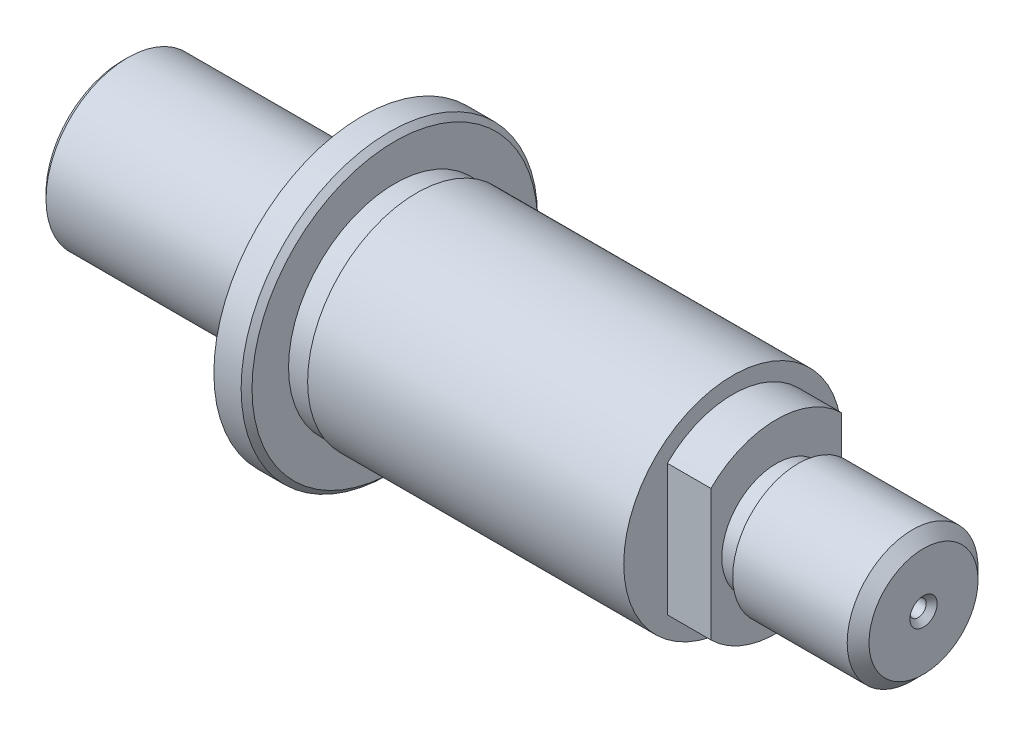
from build123d import *

# Parameters (mm, degrees)
CHANFREIN1_SIZE                     = 0.5
ENL_V_MAT_EXTRU_1_DEPTH             = 4
CHANFREIN2_SIZE                     = 1
DIAM_TRE_DU_PER_AGE_1_5_1_5_1_D     = 1.5
DIAM_TRE_DU_PER_AGE_1_5_1_5_1_DEPTH = 2
DIAM_TRE_DU_PER_AGE_1_5_1_5_1_TIP   = 0.450645464
CHANFREIN3_SIZE                     = 0.5
DIAM_TRE_DU_PER_AGE_1_5_1_5_2_D     = 1.5
DIAM_TRE_DU_PER_AGE_1_5_1_5_2_DEPTH = 2
DIAM_TRE_DU_PER_AGE_1_5_1_5_2_TIP   = 0.450645464
CHANFREIN4_SIZE                     = 0.5
BOSS_EXTRU_1_REACH                  = 77.975
ESQUISSE9_R                         = 7.5
ESQUISSE9_R_2                       = 4.5
CHANFREIN5_SIZE                     = 0.5


with BuildPart() as part:
    # Esquisse1 → Révolution1 (revolve)
    with BuildSketch(Plane.XY, mode=Mode.PRIVATE) as r_volution1_sk:
        Polygon((0, 0), (0, 5), (6, 5), (6, 4.75), (8, 4.75), (8, 7.5), (22, 7.5), (22, 13.6), (25, 13.6), (25, 9.75), (27, 9.75), (27, 10), (56, 10), (56, 8.5), (60, 8.5), (60, 5), (62, 5), (62, 6), (73.5, 6), (73.5, 0), align=None)
    revolve(r_volution1_sk.sketch.rotate(Axis((0, 0, 0), (1, 0, 0)), 90), axis=Axis((0, 0, 0), (1, 0, 0)))

    # Chanfrein1
    chanfrein1_edges = [part.edges().sort_by_distance(p)[0] for p in [
        (0, 0, -5),
        (8, 0, -4.75),
        (8, 0, -7.5),
        (25, 0, -13.6),
    ]]
    chamfer(chanfrein1_edges, length=CHANFREIN1_SIZE)

    # Esquisse2 → Enlèv. mat.-Extru.1 (cut)
    with BuildSketch(Plane(origin=(60, 0, 0), x_dir=(0, 0, -1), z_dir=(1, 0, 0))):
        with BuildLine():
            Line((-6, 12.573525265), (-6, -12.573525265))
            ThreePointArc((-6, -12.573525265), (-13.931745676, 0), (-6, 12.573525265))
        make_face()
        with BuildLine():
            Line((6, 12.573525265), (6, -12.573525265))
            ThreePointArc((6, -12.573525265), (13.931745676, 0), (6, 12.573525265))
        make_face()
    extrude(amount=-ENL_V_MAT_EXTRU_1_DEPTH, mode=Mode.SUBTRACT)

    # Chanfrein2
    chanfrein2_edges = [part.edges().sort_by_distance(p)[0] for p in [
        (73.5, 0, -6),
    ]]
    chamfer(chanfrein2_edges, length=CHANFREIN2_SIZE)

    # Diamètre du perçage Ø1.5 (1.5)1
    with Locations(Plane(origin=(73.5, 0, 0), x_dir=(0, 0, -1), z_dir=(1, 0, 0))):
        with Locations((0, 0)):
            Hole(DIAM_TRE_DU_PER_AGE_1_5_1_5_1_D / 2, depth=DIAM_TRE_DU_PER_AGE_1_5_1_5_1_DEPTH)
            with Locations((0, 0, -(DIAM_TRE_DU_PER_AGE_1_5_1_5_1_DEPTH + DIAM_TRE_DU_PER_AGE_1_5_1_5_1_TIP / 2))):  # 118° drill point
                Cone(0, DIAM_TRE_DU_PER_AGE_1_5_1_5_1_D / 2, DIAM_TRE_DU_PER_AGE_1_5_1_5_1_TIP, mode=Mode.SUBTRACT)

    # Chanfrein3
    chanfrein3_edges = [part.edges().sort_by_distance(p)[0] for p in [
        (73.5, 0, -0.75),
    ]]
    chamfer(chanfrein3_edges, length=CHANFREIN3_SIZE)

    # Diamètre du perçage Ø1.5 (1.5)2
    with Locations(Plane.ZY):
        with Locations((0, 0)):
            Hole(DIAM_TRE_DU_PER_AGE_1_5_1_5_2_D / 2, depth=DIAM_TRE_DU_PER_AGE_1_5_1_5_2_DEPTH)
            with Locations((0, 0, -(DIAM_TRE_DU_PER_AGE_1_5_1_5_2_DEPTH + DIAM_TRE_DU_PER_AGE_1_5_1_5_2_TIP / 2))):  # 118° drill point
                Cone(0, DIAM_TRE_DU_PER_AGE_1_5_1_5_2_D / 2, DIAM_TRE_DU_PER_AGE_1_5_1_5_2_TIP, mode=Mode.SUBTRACT)

    # Chanfrein4
    chanfrein4_edges = [part.edges().sort_by_distance(p)[0] for p in [
        (0, 0, 0.75),
    ]]
    chamfer(chanfrein4_edges, length=CHANFREIN4_SIZE)

    # Esquisse9 → Boss.-Extru.1 (add, up to next)
    with BuildSketch(Plane.ZY, mode=Mode.PRIVATE) as boss_extru_1_sk1:
        Circle(ESQUISSE9_R)
        Circle(ESQUISSE9_R_2, mode=Mode.SUBTRACT)
    boss_extru_1_tool1 = extrude(boss_extru_1_sk1.sketch, amount=-BOSS_EXTRU_1_REACH, mode=Mode.PRIVATE) - part.part
    add(boss_extru_1_tool1.solids().sort_by_distance((0, 0, -7.287868))[0])

    # Chanfrein5
    chanfrein5_edges = [part.edges().sort_by_distance(p)[0] for p in [
        (0, 0, -7.5),
    ]]
    chamfer(chanfrein5_edges, length=CHANFREIN5_SIZE)


solid = part.part
